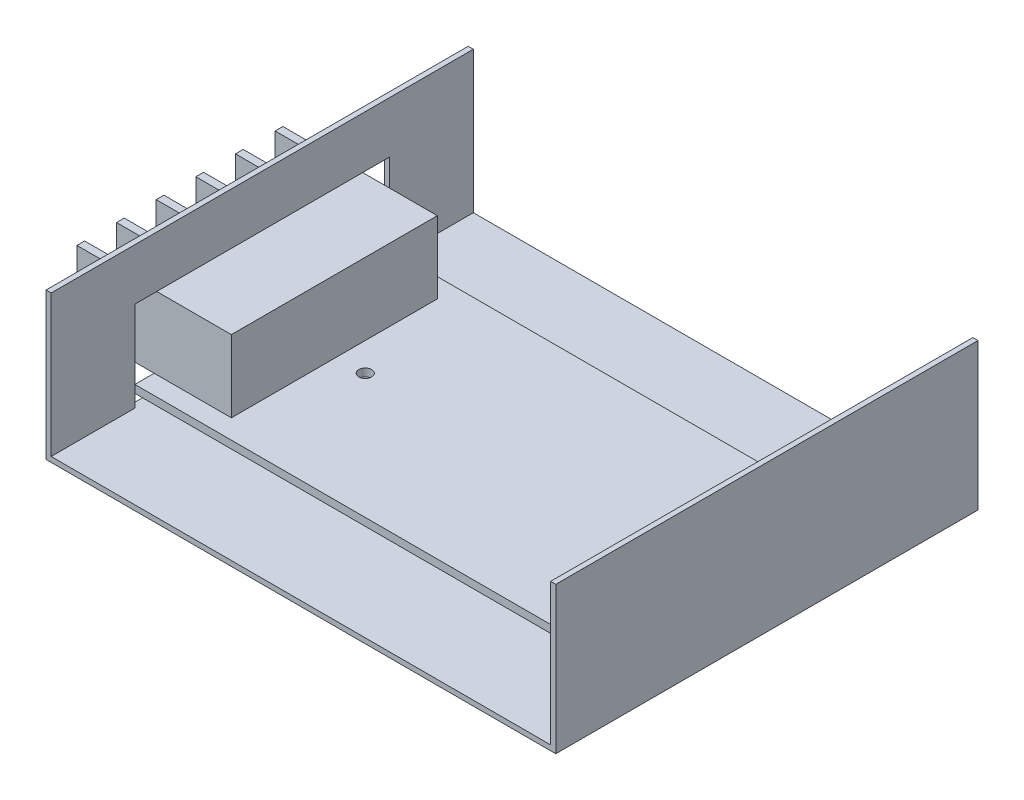
from build123d import *

# Parameters (mm, degrees)
EXTRUDE_1_DEPTH       = 82
SKETCH_2_W            = 49.5
SKETCH_2_H            = 17.5
CUT_EXTRUDE_1_DEPTH   = 10
SKETCH_3_W            = 47.5
SKETCH_3_H            = 1.5
EXTRUDE_2_DEPTH       = 98
SKETCH_4_W            = 30
SKETCH_4_H            = 40
EXTRUDE_3_DEPTH       = 14
SKETCH_5_W            = 8
SKETCH_5_H            = 6.2
CUT_EXTRUDE_2_DEPTH   = 24
CHAMFER_1_SIZE        = 2
HOLE_WIZARD_M31_D     = 2.5
HOLE_WIZARD_M31_DEPTH = 8.5
HOLE_WIZARD_M31_TIP   = 0.751075774


with BuildPart() as part:
    # Эскиз1 → Бобышка-Вытянуть1 (new body)
    with BuildSketch(Plane.XY):
        Polygon((1, 1), (98, 1), (98, 28.5), (99, 28.5), (99, 0), (0, 0), (0, 28.5), (1, 28.5), align=None)
    extrude(amount=EXTRUDE_1_DEPTH)

    # Эскиз2 → Вырез-Вытянуть1 (cut)
    with BuildSketch(Plane.ZY):
        with Locations((41, 9.75)):
            Rectangle(SKETCH_2_W, SKETCH_2_H)
    extrude(amount=-CUT_EXTRUDE_1_DEPTH, mode=Mode.SUBTRACT)

    # Эскиз3 → Бобышка-Вытянуть2 (add)
    with BuildSketch(Plane.ZY.offset(-98)):
        with Locations((41, 3.25)):
            Rectangle(SKETCH_3_W, SKETCH_3_H)
    extrude(amount=EXTRUDE_2_DEPTH)

    # Эскиз4 → Бобышка-Вытянуть3 (add)
    with BuildSketch(Plane(origin=(0, 4, 0), x_dir=(1, 0, 0), z_dir=(0, 1, 0))):
        with Locations((0, -41)):
            Rectangle(SKETCH_4_W, SKETCH_4_H)
    extrude(amount=EXTRUDE_3_DEPTH)

    # Эскиз5 → Вырез-Вытянуть2 (cut)
    with BuildSketch(Plane(origin=(0, 18, 0), x_dir=(1, 0, 0), z_dir=(0, 1, 0))):
        with Locations((-11, -25.6)):
            Rectangle(SKETCH_5_W, SKETCH_5_H)
        with Locations((-11, -56.4)):
            Rectangle(SKETCH_5_W, SKETCH_5_H)
        with Locations((-11, -33.3)):
            Rectangle(SKETCH_5_W, SKETCH_5_H)
        with Locations((-11, -41)):
            Rectangle(SKETCH_5_W, SKETCH_5_H)
        with Locations((-11, -48.7)):
            Rectangle(SKETCH_5_W, SKETCH_5_H)
    extrude(amount=-CUT_EXTRUDE_2_DEPTH, mode=Mode.SUBTRACT)

    # Фаска1
    chamfer_1_edges = [part.edges().sort_by_distance(p)[0] for p in [
        (-7, 4, 33.3),
        (-7, 18, 33.3),
        (-7, 4, 41),
        (-7, 18, 41),
        (-7, 4, 48.7),
        (-7, 18, 48.7),
        (-7, 4, 56.4),
        (-7, 18, 56.4),
        (-7, 4, 25.6),
        (-7, 18, 25.6),
    ]]
    chamfer(chamfer_1_edges, length=CHAMFER_1_SIZE)

    # Отверстие обработанное метчиком M31
    with Locations(Plane(origin=(0, 0, 0), x_dir=(-1, 0, 0), z_dir=(0, -1, 0))):
        with Locations((-20.5, -40.5), (-75.5, -40.5)):
            Hole(HOLE_WIZARD_M31_D / 2, depth=HOLE_WIZARD_M31_DEPTH)
            with Locations((0, 0, -(HOLE_WIZARD_M31_DEPTH + HOLE_WIZARD_M31_TIP / 2))):  # 118° drill point
                Cone(0, HOLE_WIZARD_M31_D / 2, HOLE_WIZARD_M31_TIP, mode=Mode.SUBTRACT)


solid = part.part
